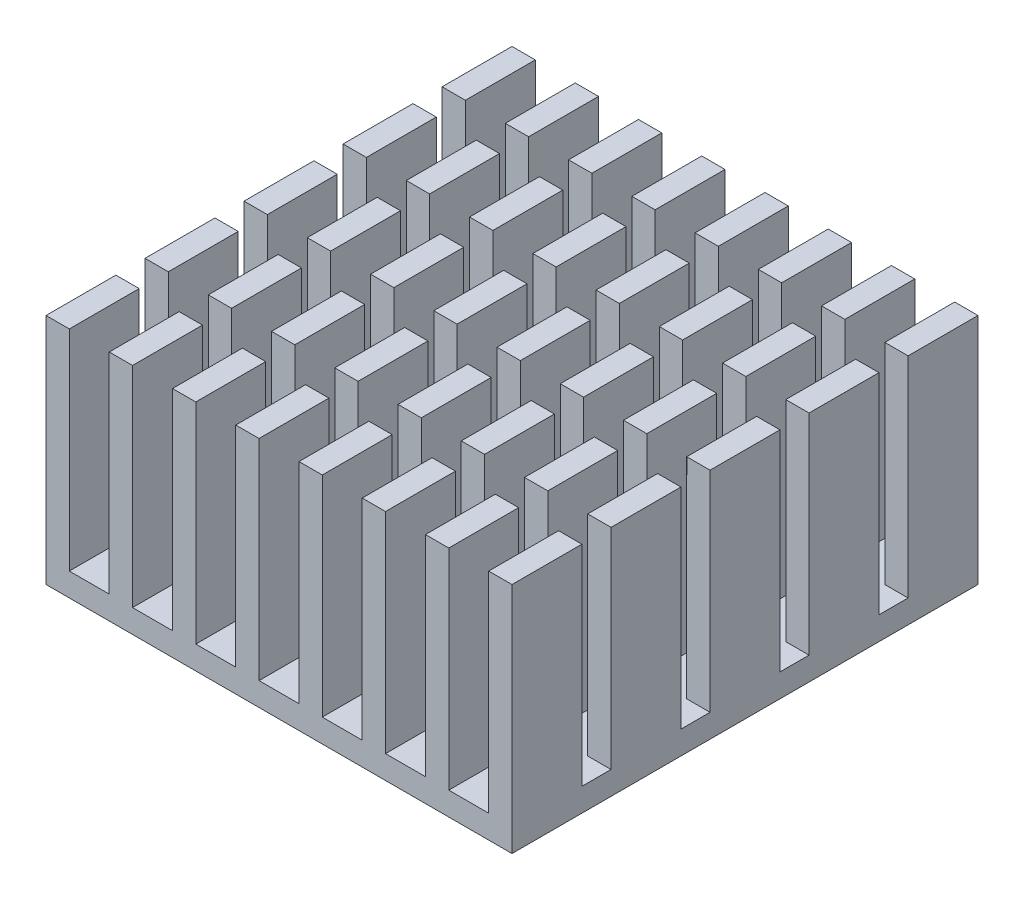
from build123d import *

# Parameters (mm, degrees)
SKETCH1_W           = 20
SKETCH1_H           = 20
BOSS_EXTRUDE1_DEPTH = 1
SKETCH2_W           = 1
SKETCH2_H           = 3
BOSS_EXTRUDE2_DEPTH = 9


with BuildPart() as part:
    # Sketch1 → Boss-Extrude1 (new body)
    with BuildSketch(Plane(origin=(0, 0, 0), x_dir=(1, 0, 0), z_dir=(0, 1, 0))):
        Rectangle(SKETCH1_W, SKETCH1_H)
    extrude(amount=BOSS_EXTRUDE1_DEPTH)

    # Sketch2 → Boss-Extrude2 (add)
    with BuildSketch(Plane(origin=(0, 1, 0), x_dir=(1, 0, 0), z_dir=(0, 1, 0))):
        with Locations((-9.5, 8.5)):
            Rectangle(SKETCH2_W, SKETCH2_H)
        with Locations((-6.78571429, 8.5)):
            Rectangle(SKETCH2_W, SKETCH2_H)
        with Locations((-4.07142858, 8.5)):
            Rectangle(SKETCH2_W, SKETCH2_H)
        with Locations((-1.35714287, 8.5)):
            Rectangle(SKETCH2_W, SKETCH2_H)
        with Locations((1.35714284, 8.5)):
            Rectangle(SKETCH2_W, SKETCH2_H)
        with Locations((4.07142855, 8.5)):
            Rectangle(SKETCH2_W, SKETCH2_H)
        with Locations((6.78571426, 8.5)):
            Rectangle(SKETCH2_W, SKETCH2_H)
        with Locations((9.49999997, 8.5)):
            Rectangle(SKETCH2_W, SKETCH2_H)
        with Locations((6.78571426, 4.25)):
            Rectangle(SKETCH2_W, SKETCH2_H)
        with Locations((4.07142855, 4.25)):
            Rectangle(SKETCH2_W, SKETCH2_H)
        with Locations((1.35714284, 4.25)):
            Rectangle(SKETCH2_W, SKETCH2_H)
        with Locations((-1.35714287, 4.25)):
            Rectangle(SKETCH2_W, SKETCH2_H)
        with Locations((-4.07142858, 4.25)):
            Rectangle(SKETCH2_W, SKETCH2_H)
        with Locations((-9.5, 4.25)):
            Rectangle(SKETCH2_W, SKETCH2_H)
        with Locations((-6.78571429, 0)):
            Rectangle(SKETCH2_W, SKETCH2_H)
        with Locations((-4.07142858, 0)):
            Rectangle(SKETCH2_W, SKETCH2_H)
        with Locations((-1.35714287, 0)):
            Rectangle(SKETCH2_W, SKETCH2_H)
        with Locations((1.35714284, 0)):
            Rectangle(SKETCH2_W, SKETCH2_H)
        with Locations((6.78571426, 0)):
            Rectangle(SKETCH2_W, SKETCH2_H)
        with Locations((9.49999997, 0)):
            Rectangle(SKETCH2_W, SKETCH2_H)
        with Locations((9.49999997, -4.25)):
            Rectangle(SKETCH2_W, SKETCH2_H)
        with Locations((6.78571426, -4.25)):
            Rectangle(SKETCH2_W, SKETCH2_H)
        with Locations((4.07142855, -4.25)):
            Rectangle(SKETCH2_W, SKETCH2_H)
        with Locations((1.35714284, -4.25)):
            Rectangle(SKETCH2_W, SKETCH2_H)
        with Locations((-1.35714287, -4.25)):
            Rectangle(SKETCH2_W, SKETCH2_H)
        with Locations((-4.07142858, -4.25)):
            Rectangle(SKETCH2_W, SKETCH2_H)
        with Locations((-6.78571429, -4.25)):
            Rectangle(SKETCH2_W, SKETCH2_H)
        with Locations((-9.5, -4.25)):
            Rectangle(SKETCH2_W, SKETCH2_H)
        with Locations((-9.5, -8.5)):
            Rectangle(SKETCH2_W, SKETCH2_H)
        with Locations((-6.78571429, -8.5)):
            Rectangle(SKETCH2_W, SKETCH2_H)
        with Locations((-4.07142858, -8.5)):
            Rectangle(SKETCH2_W, SKETCH2_H)
        with Locations((-1.35714287, -8.5)):
            Rectangle(SKETCH2_W, SKETCH2_H)
        with Locations((1.35714284, -8.5)):
            Rectangle(SKETCH2_W, SKETCH2_H)
        with Locations((4.07142855, -8.5)):
            Rectangle(SKETCH2_W, SKETCH2_H)
        with Locations((6.78571426, -8.5)):
            Rectangle(SKETCH2_W, SKETCH2_H)
        with Locations((9.49999997, -8.5)):
            Rectangle(SKETCH2_W, SKETCH2_H)
        with Locations((9.49999997, 4.25)):
            Rectangle(SKETCH2_W, SKETCH2_H)
        with Locations((-6.78571429, 4.25)):
            Rectangle(SKETCH2_W, SKETCH2_H)
        with Locations((-9.5, 0)):
            Rectangle(SKETCH2_W, SKETCH2_H)
        with Locations((4.07142855, 0)):
            Rectangle(SKETCH2_W, SKETCH2_H)
    extrude(amount=BOSS_EXTRUDE2_DEPTH)


solid = part.part
